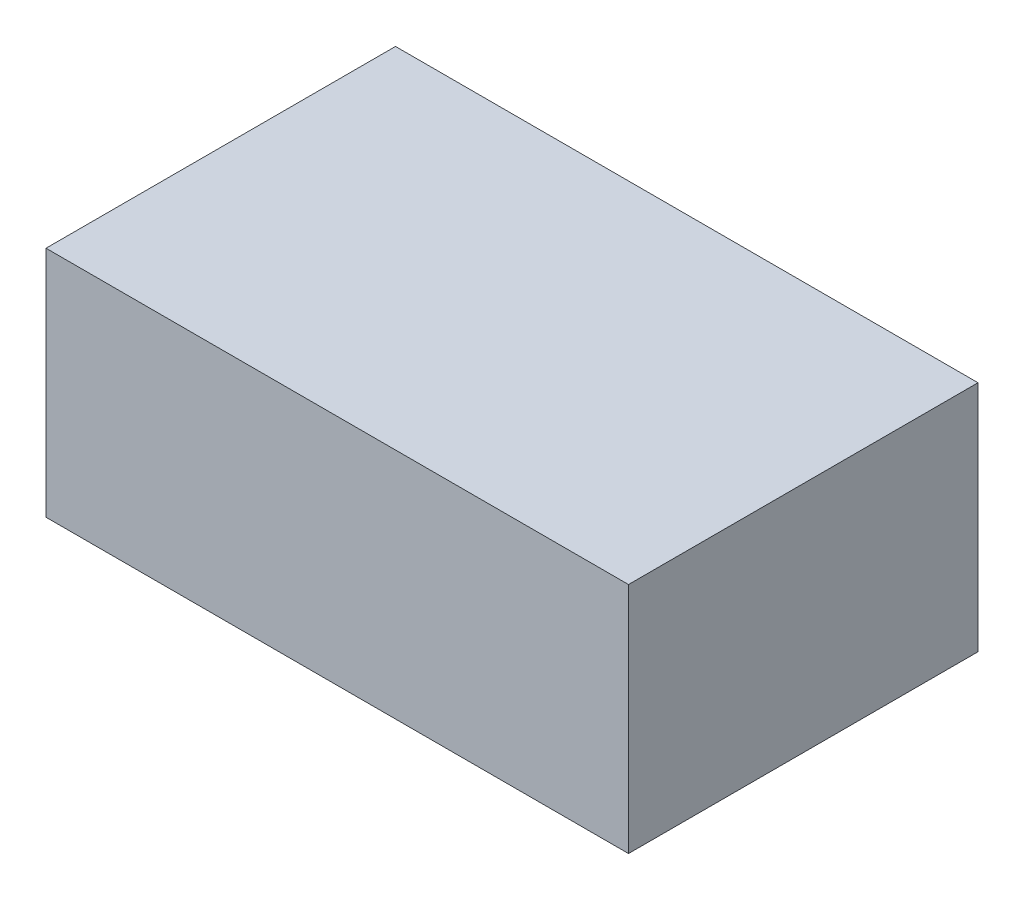
from build123d import *

# Parameters (mm, degrees)
CROQUIS_BASE_W             = 125
CROQUIS_BASE_H             = 75
CAJA_BAJA_DEPTH            = 50
CROQUIS_AGUJEROS_MONTAJE_R = 4
AGUJERO_INSERTO_M6_DEPTH   = 14


with BuildPart() as part:
    # Croquis_base → Caja_baja (new body)
    with BuildSketch(Plane(origin=(0, 0, 0), x_dir=(1, 0, 0), z_dir=(0, 1, 0))):
        Rectangle(CROQUIS_BASE_W, CROQUIS_BASE_H)
    extrude(amount=CAJA_BAJA_DEPTH)

    # Croquis_agujeros_montaje → Agujero_inserto_M6 (cut)
    with BuildSketch(Plane(origin=(0, 0, 0), x_dir=(1, 0, 0), z_dir=(0, 1, 0))):
        with Locations(Location((-50, 0, 0), (0, 0, 270))):
            Circle(CROQUIS_AGUJEROS_MONTAJE_R)
        with Locations(Location((50, 0, 0), (0, 0, 270))):
            Circle(CROQUIS_AGUJEROS_MONTAJE_R)
    extrude(amount=AGUJERO_INSERTO_M6_DEPTH, mode=Mode.SUBTRACT)


solid = part.part
